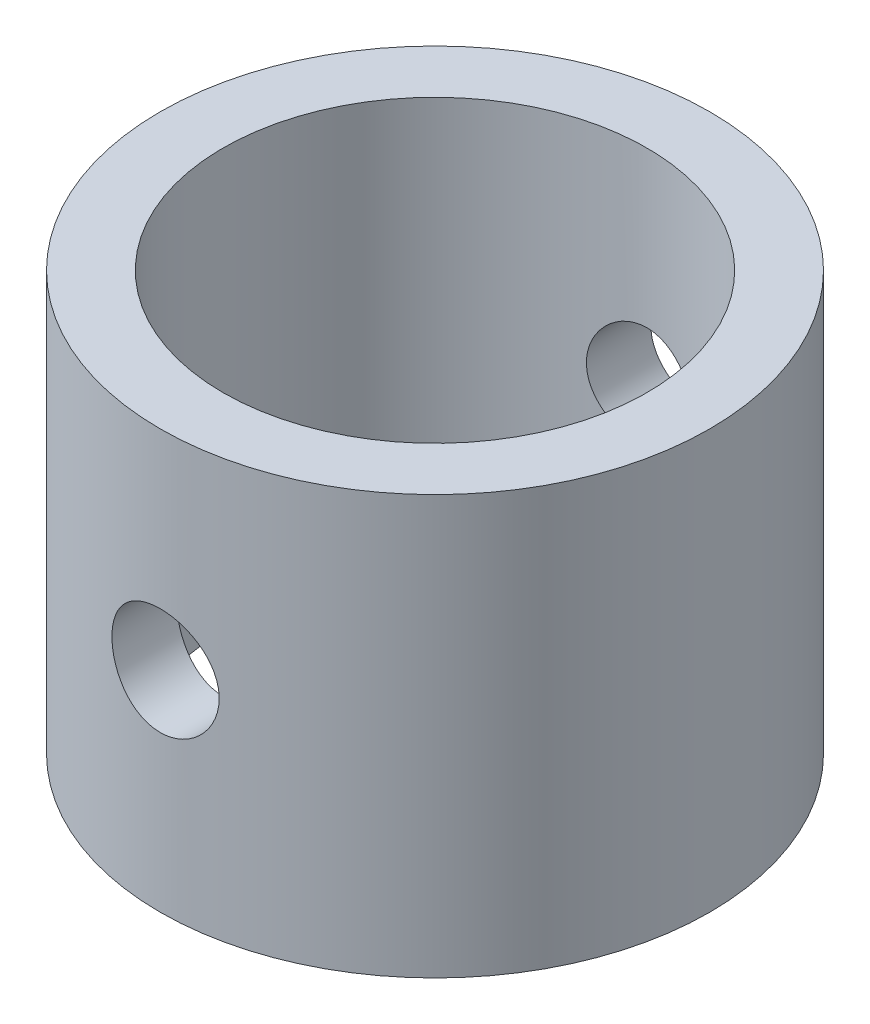
from build123d import *

# Parameters (mm, degrees)
SKETCH1_R               = 5.25
SKETCH1_R_2             = 4.05
BOSS_EXTRUDE1_DEPTH     = 4
CUT_EXTRUDE1_DEPTH      = 9.433563897
CUT_EXTRUDE1_DEPTH_BACK = 9.433563897
SKETCH3_R               = 1.025


with BuildPart() as part:
    # Sketch1 → Boss-Extrude1 (new, symmetric)
    with BuildSketch(Plane(origin=(0, 0, 0), x_dir=(1, 0, 0), z_dir=(0, 1, 0))):
        with Locations(Location((0, 0, 0), (0, 0, 270))):
            Circle(SKETCH1_R)
        with Locations(Location((0, 0, 0), (0, 0, 270))):
            Circle(SKETCH1_R_2, mode=Mode.SUBTRACT)
    extrude(amount=BOSS_EXTRUDE1_DEPTH, both=True)

    # Sketch3 → Cut-Extrude1 (cut, two sides: drawn at the far end of the back side and taken through both)
    with BuildSketch(Plane.XY.offset(-CUT_EXTRUDE1_DEPTH_BACK)):
        Circle(SKETCH3_R)
    extrude(amount=CUT_EXTRUDE1_DEPTH + CUT_EXTRUDE1_DEPTH_BACK, mode=Mode.SUBTRACT)


solid = part.part
